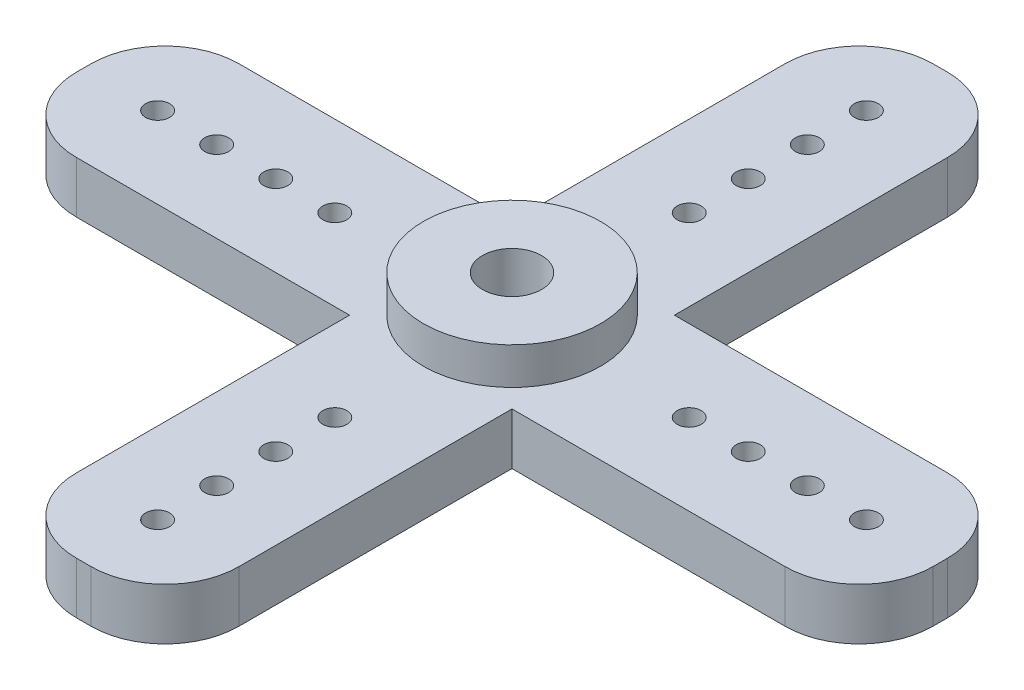
from build123d import *

# Parameters (mm, degrees)
SKETCH1_W                = 5.5
SKETCH1_H                = 14.5
SKETCH1_R                = 0.4064
BOSS_EXTRUDE1_DEPTH      = 1.75
FILLET1_R                = 2.5
CIRPATTERN1_COUNT        = 4
FILLET1_OF_CIRPATTERN1_R = 2.5
CUT_EXTRUDE1_REACH       = 22.581
SKETCH2_R                = 1
BOSS_EXTRUDE2_START      = 1.25
SKETCH3_R                = 3
SKETCH3_R_2              = 1
BOSS_EXTRUDE2_DEPTH      = 1.25


with BuildPart() as part:
    # Sketch1 → Boss-Extrude1 (new body)
    with BuildSketch(Plane(origin=(0, 0, 0), x_dir=(1, 0, 0), z_dir=(0, 1, 0))):
        with Locations((0, 7.25)):
            Rectangle(SKETCH1_W, SKETCH1_H)
        with Locations((0, 12)):
            Circle(SKETCH1_R, mode=Mode.SUBTRACT)
        with Locations((0, 10)):
            Circle(SKETCH1_R, mode=Mode.SUBTRACT)
        with Locations((0, 8)):
            Circle(SKETCH1_R, mode=Mode.SUBTRACT)
        with Locations((0, 6)):
            Circle(SKETCH1_R, mode=Mode.SUBTRACT)
    boss_extrude1 = extrude(amount=BOSS_EXTRUDE1_DEPTH)

    # Fillet1
    fillet1_edges = [part.edges().sort_by_distance(p)[0] for p in [
        (-2.75, 0.875, -14.5),
        (2.75, 0.875, -14.5),
    ]]
    fillet(fillet1_edges, radius=FILLET1_R)

    # CirPattern1: Boss-Extrude1 ×4 about axis
    cirpattern1_axis = Axis((0, 0, 0), (0, 1, 0))
    for i in range(1, CIRPATTERN1_COUNT):
        add(boss_extrude1.rotate(cirpattern1_axis, i * 360 / CIRPATTERN1_COUNT))

    # Fillet1 of CirPattern1
    fillet1_of_cirpattern1_edges = [part.edges().sort_by_distance(p)[0] for p in [
        (-14.5, 0.875, 2.75),
        (-14.5, 0.875, -2.75),
        (2.75, 0.875, 14.5),
        (-2.75, 0.875, 14.5),
        (14.5, 0.875, -2.75),
        (14.5, 0.875, 2.75),
    ]]
    fillet(fillet1_of_cirpattern1_edges, radius=FILLET1_OF_CIRPATTERN1_R)

    # Sketch2 → Cut-Extrude1 (cut, up to next)
    with BuildSketch(Plane(origin=(0, 1.75, 0), x_dir=(1, 0, 0), z_dir=(0, 1, 0)), mode=Mode.PRIVATE) as cut_extrude1_sk1:
        Circle(SKETCH2_R)
    cut_extrude1_tool1 = extrude(cut_extrude1_sk1.sketch, amount=-CUT_EXTRUDE1_REACH, mode=Mode.PRIVATE) & part.part
    add(cut_extrude1_tool1.solids().sort_by_distance((0, 1.75, 0))[0], mode=Mode.SUBTRACT)

    # Sketch3 → Boss-Extrude2 (add)
    with BuildSketch(Plane(origin=(0, 1.75, 0), x_dir=(1, 0, 0), z_dir=(0, 1, 0)).offset(BOSS_EXTRUDE2_START)):
        Circle(SKETCH3_R)
        Circle(SKETCH3_R_2, mode=Mode.SUBTRACT)
    extrude(amount=-BOSS_EXTRUDE2_DEPTH)


solid = part.part
